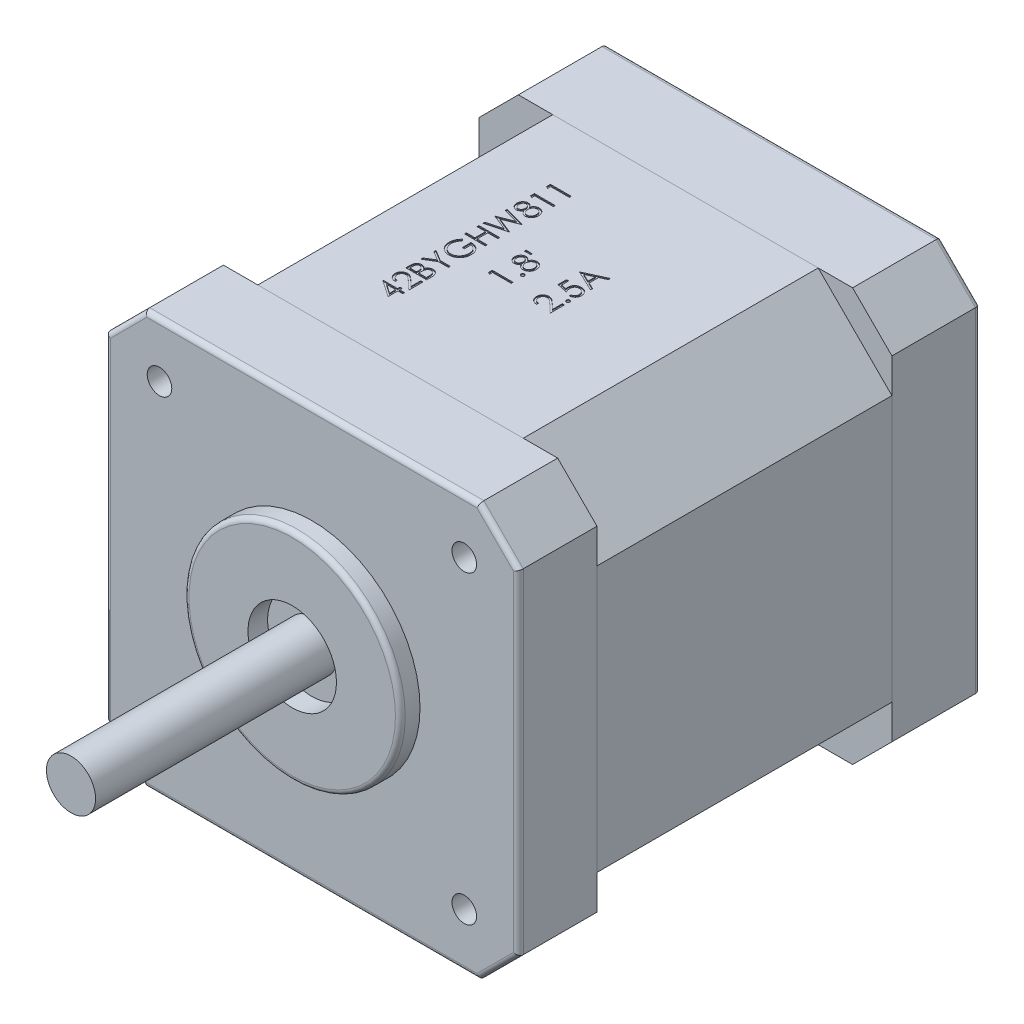
from build123d import *

# Parameters (mm, degrees)
IZIM1_R                     = 2.5
Y_KSEKLIK_EKSTR_ZYON1_DEPTH = 24.5
IZIM1_4_R                   = 11
IZIM1_4_R_2                 = 4.5
Y_KSEKLIK_EKSTR_ZYON2_DEPTH = 2
Y_KSEKLIK_EKSTR_ZYON3_START = -8
IZIM1_5_W                   = 42
IZIM1_5_H                   = 42
IZIM1_5_R                   = 11
IZIM1_5_R_2                 = 4.5
IZIM1_5_R_3                 = 2.5
Y_KSEKLIK_EKSTR_ZYON3_DEPTH = 8
PAH1_SIZE                   = 4
Y_KSEKLIK_EKSTR_ZYON4_DEPTH = 30
Y_KSEKLIK_EKSTR_ZYON5_DEPTH = 9
IZIM4_R                     = 4.5
KES_EKSTR_ZYON1_DEPTH       = 3.5
M3_DI_LI_DELIK1_D           = 2.5
M3_DI_LI_DELIK1_DEPTH       = 7
M3_DI_LI_DELIK1_TIP         = 0.751075774
RADYUS1_R                   = 0.5
RADYUS2_R                   = 0.5
KES_EKSTR_ZYON2_DEPTH       = 0.1
IZIM11_R                    = 0.6


with BuildPart() as part:
    # Çizim1 → Yükseklik-Ekstrüzyon1 (new body)
    with BuildSketch(Plane.XY):
        Circle(IZIM1_R)
    extrude(amount=Y_KSEKLIK_EKSTR_ZYON1_DEPTH)



with BuildPart() as body_2:
    # Çizim1<4> → Yükseklik-Ekstrüzyon2 (new body)
    with BuildSketch(Plane.XY):
        Circle(IZIM1_4_R)
        Circle(IZIM1_4_R_2, mode=Mode.SUBTRACT)
    extrude(amount=Y_KSEKLIK_EKSTR_ZYON2_DEPTH)


with BuildPart() as part_1:
    add(part.part)

    add(body_2.part)  # Yükseklik-Ekstrüzyon3 merges body 2
    # Çizim1<5> → Yükseklik-Ekstrüzyon3 (add)
    # profile 1 of 4: a face of its own
    with BuildSketch(Plane.XY.offset(Y_KSEKLIK_EKSTR_ZYON3_START)):
        Rectangle(IZIM1_5_W, IZIM1_5_H)
        Circle(IZIM1_5_R, mode=Mode.SUBTRACT)
    # profile 2 of 4: a face of its own
    with BuildSketch(Plane.XY.offset(Y_KSEKLIK_EKSTR_ZYON3_START)):
        Circle(IZIM1_5_R)
        Circle(IZIM1_5_R_2, mode=Mode.SUBTRACT)
    # profile 3 of 4: a face of its own
    with BuildSketch(Plane.XY.offset(Y_KSEKLIK_EKSTR_ZYON3_START)):
        Circle(IZIM1_5_R_2)
        Circle(IZIM1_5_R_3, mode=Mode.SUBTRACT)
    # profile 4 of 4: a face of its own
    with BuildSketch(Plane.XY.offset(Y_KSEKLIK_EKSTR_ZYON3_START)):
        Circle(IZIM1_5_R_3)
    extrude(amount=Y_KSEKLIK_EKSTR_ZYON3_DEPTH)

    # Pah1
    pah1_edges = [part_1.edges().sort_by_distance(p)[0] for p in [
        (-21, -21, -4),
        (-21, 21, -4),
        (21, 21, -4),
        (21, -21, -4),
    ]]
    chamfer(pah1_edges, length=PAH1_SIZE)

    # Çizim2 → Yükseklik-Ekstrüzyon4 (add)
    with BuildSketch(Plane(origin=(0, 0, -8), x_dir=(-1, 0, 0), z_dir=(0, 0, -1))):
        Polygon((-13.5, 21), (13.5, 21), (21, 13.5), (21, -13.5), (13.5, -21), (-13.5, -21), (-21, -13.5), (-21, 13.5), align=None)
    extrude(amount=Y_KSEKLIK_EKSTR_ZYON4_DEPTH)

    # Çizim3 → Yükseklik-Ekstrüzyon5 (add)
    with BuildSketch(Plane(origin=(0, 0, -38), x_dir=(-1, 0, 0), z_dir=(0, 0, -1))):
        Polygon((-17, -21), (17, -21), (21, -17), (21, 17), (17, 21), (-17, 21), (-21, 17), (-21, -17), align=None)
    extrude(amount=Y_KSEKLIK_EKSTR_ZYON5_DEPTH)

    # Çizim4 → Kes-Ekstrüzyon1 (cut)
    with BuildSketch(Plane(origin=(0, 0, -47), x_dir=(-1, 0, 0), z_dir=(0, 0, -1))):
        with Locations(Location((0, 0, 0), (0, 0, 180))):
            Circle(IZIM4_R)
    extrude(amount=-KES_EKSTR_ZYON1_DEPTH, mode=Mode.SUBTRACT)

    # M3 Dişli Delik1
    with Locations(Plane.XY):
        with Locations((-15.5, 15.5), (15.5, 15.5), (15.5, -15.5), (-15.5, -15.5)):
            Hole(M3_DI_LI_DELIK1_D / 2, depth=M3_DI_LI_DELIK1_DEPTH)
            with Locations((0, 0, -(M3_DI_LI_DELIK1_DEPTH + M3_DI_LI_DELIK1_TIP / 2))):  # 118° drill point
                Cone(0, M3_DI_LI_DELIK1_D / 2, M3_DI_LI_DELIK1_TIP, mode=Mode.SUBTRACT)

    # Radyus1
    radyus1_edges = [part_1.edges().sort_by_distance(p)[0] for p in [
        (-11, 0, 2),
    ]]
    fillet(radyus1_edges, radius=RADYUS1_R)

    # Radyus2
    radyus2_edges = [part_1.edges().sort_by_distance(p)[0] for p in [
        (-4.5, 0, -47),
        (0, -21, 0),
        (-21, 0, 0),
        (21, 0, 0),
        (0, 21, 0),
        (19, 19, 0),
        (-19, 19, 0),
        (-19, -19, 0),
        (19, -19, 0),
        (-19, -19, -47),
        (-21, 0, -47),
        (-19, 19, -47),
        (0, 21, -47),
        (19, 19, -47),
        (21, 0, -47),
        (19, -19, -47),
        (0, -21, -47),
    ]]
    fillet(radyus2_edges, radius=RADYUS2_R)

    # Çizim9 → Kes-Ekstrüzyon2 (cut)
    # profile 1 of 18: a face of its own
    with BuildSketch(Plane(origin=(0, 21, 0), x_dir=(1, 0, 0), z_dir=(0, 1, 0))):
        Polygon((-7.48076484, 31.358758021), (-7.48076484, 31.750120868), (-5.364098173, 31.750120868), (-5.364098173, 31.560163603), (-7.263670823, 31.560163603), (-7.263670823, 31.234522577), align=None)
    # profile 2 of 18: a face of its own
    with BuildSketch(Plane(origin=(0, 21, 0), x_dir=(1, 0, 0), z_dir=(0, 1, 0))):
        Polygon((-7.48076484, 29.730552893), (-7.48076484, 30.12191574), (-5.364098173, 30.12191574), (-5.364098173, 29.931958475), (-7.263670823, 29.931958475), (-7.263670823, 29.606317449), align=None)
    # profile 3 of 18: a face of its own
    with BuildSketch(Plane(origin=(0, 21, 0), x_dir=(1, 0, 0), z_dir=(0, 1, 0))):
        with BuildLine():
            add(Edge.make_bspline(
                [(-6.543274856, 28.681547818), (-6.534253768, 28.698882093), (-6.516659635, 28.732689719), (-6.488152234, 28.780626515), (-6.45888197, 28.825043357), (-6.428289612, 28.865697076), (-6.397059915, 28.90310779), (-6.364791186, 28.936723711), (-6.331527054, 28.966686908), (-6.297144511, 28.992949637), (-6.261637512, 29.01619211), (-6.224780324, 29.035908924), (-6.187070227, 29.053109242), (-6.147944074, 29.066611163), (-6.107936156, 29.077758044), (-6.066510295, 29.085422119), (-6.023944767, 29.089545175), (-5.995177238, 29.09032454), (-5.980611261, 29.090719159)],
                knots=[0, 0, 0, 0, 1.272232798, 2.48127884, 3.629933602, 4.734339846, 5.792529071, 6.8014233, 7.765980239, 8.70477066, 9.616091719, 10.526157162, 11.424183119, 12.311964017, 13.218439077, 14.126407968, 15.05133675, 16, 16, 16, 16], degree=3))
            add(Edge.make_bspline(
                [(-5.980611261, 29.090719159), (-5.960232667, 29.090251116), (-5.919895782, 29.089324684), (-5.860351898, 29.081303416), (-5.802424948, 29.069151179), (-5.746227356, 29.051848089), (-5.69229116, 29.028724822), (-5.640304419, 29.000759187), (-5.589380456, 28.968920348), (-5.558040871, 28.943370755), (-5.542183109, 28.930442716)],
                knots=[0, 0, 0, 0, 1.025234619, 2.029323995, 3.018511574, 4.001747246, 4.983437759, 5.966776356, 6.971193253, 8, 8, 8, 8], degree=3))
            add(Edge.make_bspline(
                [(-5.542183109, 28.930442716), (-5.52368116, 28.913608277), (-5.486905895, 28.880147427), (-5.439159453, 28.822826323), (-5.399033867, 28.75991785), (-5.366333245, 28.69166543), (-5.340881321, 28.618251507), (-5.322591798, 28.539691723), (-5.312115853, 28.455832926), (-5.310601535, 28.398195807), (-5.309824669, 28.368627145)],
                knots=[0, 0, 0, 0, 0.954267603, 1.896743057, 2.838368354, 3.796610408, 4.779680527, 5.799409237, 6.871065594, 8, 8, 8, 8], degree=3))
            add(Edge.make_bspline(
                [(-5.309824669, 28.368627145), (-5.310521644, 28.340195238), (-5.311877886, 28.284869636), (-5.321066899, 28.204340824), (-5.33717042, 28.129275923), (-5.359210726, 28.059238455), (-5.387882644, 27.994650713), (-5.423568618, 27.935696505), (-5.464832628, 27.881526103), (-5.512858364, 27.833780322), (-5.564301308, 27.79140065), (-5.617358856, 27.754141293), (-5.671990135, 27.723346384), (-5.72736472, 27.69680369), (-5.784604471, 27.677050764), (-5.843122014, 27.663040688), (-5.902751097, 27.654240405), (-5.942985755, 27.653063411), (-5.963226779, 27.652471295)],
                knots=[0, 0, 0, 0, 1.25688423, 2.445769047, 3.576901867, 4.645929967, 5.686364546, 6.692558921, 7.686102643, 8.689032542, 9.678639083, 10.630214757, 11.550908986, 12.44815258, 13.341318614, 14.221806242, 15.105436345, 16, 16, 16, 16], degree=3))
            add(Edge.make_bspline(
                [(-5.963226779, 27.652471295), (-5.978079198, 27.652820878), (-6.00743282, 27.653511777), (-6.050800536, 27.658290847), (-6.093008186, 27.665981929), (-6.134225967, 27.676399487), (-6.174223055, 27.690664312), (-6.213255716, 27.707526057), (-6.251068002, 27.727571747), (-6.287940088, 27.750584344), (-6.323431869, 27.777375896), (-6.358116199, 27.807734631), (-6.391556957, 27.84206515), (-6.423561436, 27.880612719), (-6.45578492, 27.922023826), (-6.485840557, 27.968050041), (-6.516002545, 28.017229588), (-6.534028107, 28.052189265), (-6.543274856, 28.070122871)],
                knots=[0, 0, 0, 0, 0.941515718, 1.860767376, 2.762381872, 3.659935523, 4.55260077, 5.451495189, 6.353332278, 7.263234701, 8.204067976, 9.169206831, 10.183030162, 11.238523545, 12.34427893, 13.507326683, 14.721309093, 16, 16, 16, 16], degree=3))
            add(Edge.make_bspline(
                [(-6.543274856, 28.070122871), (-6.556702083, 28.045607178), (-6.582660298, 27.998212163), (-6.629722407, 27.934815616), (-6.681807098, 27.881200726), (-6.738380258, 27.837324513), (-6.798312673, 27.802960483), (-6.861105408, 27.779355845), (-6.925645395, 27.763394239), (-6.969735998, 27.761812626), (-6.99187929, 27.761018304)],
                knots=[0, 0, 0, 0, 1.166795445, 2.255709742, 3.287146686, 4.280506455, 5.237809939, 6.161201476, 7.076514059, 8, 8, 8, 8], degree=3))
            add(Edge.make_bspline(
                [(-6.99187929, 27.761018304), (-7.014434415, 27.762009081), (-7.059774151, 27.764000717), (-7.12728494, 27.780050579), (-7.193629536, 27.806401938), (-7.258645004, 27.841636061), (-7.319404266, 27.886451869), (-7.37415459, 27.939508983), (-7.422098209, 28.000380217), (-7.462366798, 28.068502961), (-7.495133403, 28.141824336), (-7.517738879, 28.219182273), (-7.532516797, 28.29923265), (-7.53418998, 28.353720296), (-7.535038344, 28.381347497)],
                knots=[0, 0, 0, 0, 0.888671842, 1.786385383, 2.719922424, 3.697584571, 4.694127107, 5.68736021, 6.695307759, 7.740011808, 8.800474061, 9.853175224, 10.911482437, 12, 12, 12, 12], degree=3))
            add(Edge.make_bspline(
                [(-7.535038344, 28.381347497), (-7.534163684, 28.408261743), (-7.532438953, 28.46133357), (-7.518053082, 28.539344116), (-7.49402796, 28.613988623), (-7.46142632, 28.684998614), (-7.421302427, 28.751143659), (-7.372657328, 28.809394746), (-7.318552835, 28.861275345), (-7.257447409, 28.903949476), (-7.192682004, 28.938908334), (-7.125097585, 28.963521739), (-7.05605486, 28.979196786), (-7.009345548, 28.981179011), (-6.985943125, 28.98217215)],
                knots=[0, 0, 0, 0, 1.072838999, 2.115516285, 3.151283082, 4.193045685, 5.225601509, 6.226687556, 7.21162948, 8.206378771, 9.189883966, 10.138656908, 11.067424936, 12, 12, 12, 12], degree=3))
            add(Edge.make_bspline(
                [(-6.985943125, 28.98217215), (-6.962978438, 28.981299209), (-6.917877096, 28.979584802), (-6.852222201, 28.965356673), (-6.790871353, 28.941012482), (-6.732836711, 28.908206273), (-6.679294483, 28.86507899), (-6.6291198, 28.813003892), (-6.582888678, 28.751435519), (-6.556755652, 28.705330977), (-6.543274856, 28.681547818)],
                knots=[0, 0, 0, 0, 0.97540661, 1.915643144, 2.83819279, 3.771804602, 4.738123289, 5.749225578, 6.838931607, 8, 8, 8, 8], degree=3))
        make_face()
        with BuildLine():
            add(Edge.make_bspline(
                [(-7.317944327, 28.370747204), (-7.317551636, 28.355899293), (-7.31678336, 28.326850286), (-7.312738607, 28.284264977), (-7.304969269, 28.243736491), (-7.294325381, 28.205043203), (-7.281082251, 28.168052565), (-7.263633977, 28.133612838), (-7.244240147, 28.10056665), (-7.221492068, 28.069998113), (-7.196673422, 28.042325825), (-7.170754255, 28.017609594), (-7.142970482, 27.997473536), (-7.114712088, 27.980149747), (-7.084806986, 27.967284414), (-7.053909957, 27.958145325), (-7.021825301, 27.951677521), (-6.999967843, 27.951211371), (-6.988911207, 27.950975569)],
                knots=[0, 0, 0, 0, 1.20353747, 2.354645537, 3.462130888, 4.543058862, 5.604822423, 6.639552563, 7.666902586, 8.706944258, 9.720926464, 10.677177239, 11.602682187, 12.496457588, 13.358248655, 14.231532794, 15.105417644, 16, 16, 16, 16], degree=3))
            add(Edge.make_bspline(
                [(-6.988911207, 27.950975569), (-6.977855852, 27.951391262), (-6.95600888, 27.952212732), (-6.923747333, 27.958565833), (-6.892044724, 27.968034503), (-6.861654887, 27.982942283), (-6.831523618, 28.000822891), (-6.802403978, 28.022891545), (-6.774194626, 28.049192053), (-6.747135497, 28.078841981), (-6.721796721, 28.111143244), (-6.699799607, 28.145363118), (-6.681394216, 28.181072126), (-6.666075957, 28.217903377), (-6.654168233, 28.256232248), (-6.645720528, 28.295823877), (-6.640469987, 28.336684919), (-6.639842836, 28.36437127), (-6.639525524, 28.378379415)],
                knots=[0, 0, 0, 0, 0.873023192, 1.725219244, 2.590779336, 3.480155217, 4.391973325, 5.357036234, 6.360879153, 7.436073238, 8.526419356, 9.601555421, 10.645666583, 11.697338044, 12.750135903, 13.812665442, 14.89329948, 16, 16, 16, 16], degree=3))
            add(Edge.make_bspline(
                [(-6.639525524, 28.378379415), (-6.640050738, 28.396372222), (-6.641095981, 28.432180121), (-6.650902959, 28.484947407), (-6.666134124, 28.536383319), (-6.68775201, 28.585514603), (-6.714109407, 28.631461924), (-6.745192156, 28.672929378), (-6.781730208, 28.708181629), (-6.821604083, 28.738172324), (-6.86390063, 28.761620801), (-6.906519974, 28.779582702), (-6.949813167, 28.790160676), (-6.978822936, 28.791535726), (-6.993151325, 28.792214885)],
                knots=[0, 0, 0, 0, 1.076561449, 2.142489767, 3.202892658, 4.283174188, 5.348766409, 6.369549039, 7.375093932, 8.378927502, 9.349008457, 10.26378795, 11.142457041, 12, 12, 12, 12], degree=3))
            add(Edge.make_bspline(
                [(-6.993151325, 28.792214885), (-7.003208953, 28.791898332), (-7.023171904, 28.791270019), (-7.052756886, 28.785909047), (-7.081652838, 28.777481166), (-7.109919491, 28.765419305), (-7.137420534, 28.749929571), (-7.164886329, 28.731822333), (-7.191047006, 28.709350684), (-7.216810805, 28.684346216), (-7.240584431, 28.655928371), (-7.261647889, 28.624368631), (-7.278821837, 28.589299222), (-7.293409146, 28.551471745), (-7.304213397, 28.51047856), (-7.312352627, 28.466704923), (-7.316928715, 28.419746571), (-7.317598447, 28.387434571), (-7.317944327, 28.370747204)],
                knots=[0, 0, 0, 0, 0.814197944, 1.616066217, 2.427603245, 3.248455667, 4.099186941, 4.981981106, 5.90846497, 6.888109974, 7.887887681, 8.904052014, 9.953721043, 11.044545063, 12.183287691, 13.382474488, 14.648192314, 16, 16, 16, 16], degree=3))
        make_face(mode=Mode.SUBTRACT)
        with BuildLine():
            add(Edge.make_bspline(
                [(-6.422431507, 28.383043544), (-6.422096465, 28.364219972), (-6.421439194, 28.327292717), (-6.414131048, 28.273190915), (-6.403941903, 28.221276233), (-6.388542964, 28.17168812), (-6.368341665, 28.124639004), (-6.344792295, 28.079324212), (-6.316131377, 28.03684936), (-6.283567863, 27.997301237), (-6.248453816, 27.96101112), (-6.210896371, 27.929614833), (-6.172350331, 27.90254782), (-6.131936601, 27.880901426), (-6.090547428, 27.863107984), (-6.04711952, 27.851429365), (-6.002496261, 27.84394093), (-5.972161293, 27.842935494), (-5.956866603, 27.84242856)],
                knots=[0, 0, 0, 0, 1.140120093, 2.236637429, 3.303440304, 4.343881959, 5.376465234, 6.40341898, 7.434544382, 8.475444373, 9.50525236, 10.49018835, 11.438301835, 12.354413346, 13.264416842, 14.162243115, 15.073415118, 16, 16, 16, 16], degree=3))
            add(Edge.make_bspline(
                [(-5.956866603, 27.84242856), (-5.937862927, 27.84327052), (-5.900022071, 27.844947062), (-5.844216202, 27.857702001), (-5.790358932, 27.878811974), (-5.738701029, 27.907713215), (-5.690391775, 27.943721779), (-5.648173451, 27.987785079), (-5.611265075, 28.037810207), (-5.580842584, 28.094558127), (-5.556856718, 28.156851216), (-5.539481752, 28.22412554), (-5.528641199, 28.295910184), (-5.527501905, 28.345408413), (-5.526918686, 28.370747204)],
                knots=[0, 0, 0, 0, 0.898929492, 1.789983246, 2.69439732, 3.628772362, 4.584083338, 5.535003999, 6.506411961, 7.518169435, 8.572915583, 9.658441722, 10.801325702, 12, 12, 12, 12], degree=3))
            add(Edge.make_bspline(
                [(-5.526918686, 28.370747204), (-5.527303848, 28.390551827), (-5.528054268, 28.429137584), (-5.534526719, 28.485453906), (-5.545131095, 28.538463206), (-5.559367314, 28.588598373), (-5.578594462, 28.635440763), (-5.602096835, 28.679192087), (-5.629096435, 28.72040248), (-5.661048106, 28.757216478), (-5.695208648, 28.790738885), (-5.731366391, 28.819969399), (-5.768544766, 28.845343631), (-5.807582375, 28.865259043), (-5.847730669, 28.881180152), (-5.889359759, 28.892624399), (-5.932597353, 28.899685729), (-5.961927744, 28.90039989), (-5.976795155, 28.900761894)],
                knots=[0, 0, 0, 0, 1.224881218, 2.3864614, 3.501053153, 4.5663711, 5.605533372, 6.626474706, 7.635288001, 8.646258782, 9.635558885, 10.592810877, 11.51917626, 12.414699553, 13.29797396, 14.186770504, 15.080884095, 16, 16, 16, 16], degree=3))
            add(Edge.make_bspline(
                [(-5.976795155, 28.900761894), (-5.991235286, 28.9002141), (-6.019708703, 28.899133948), (-6.061900474, 28.892277522), (-6.102664524, 28.880234786), (-6.142482785, 28.863702022), (-6.18058093, 28.84172416), (-6.21791194, 28.8156582), (-6.253837174, 28.784686123), (-6.287855769, 28.749188827), (-6.319293601, 28.710694649), (-6.34723457, 28.669905409), (-6.370070277, 28.626627756), (-6.389254068, 28.581720958), (-6.404204071, 28.534731794), (-6.414687222, 28.485887048), (-6.421275872, 28.43509415), (-6.422041943, 28.400589761), (-6.422431507, 28.383043544)],
                knots=[0, 0, 0, 0, 0.917285732, 1.808727228, 2.70647511, 3.61182169, 4.540502712, 5.494399442, 6.50027777, 7.547876848, 8.61347749, 9.654284431, 10.682470341, 11.71628462, 12.752590585, 13.809114363, 14.885888007, 16, 16, 16, 16], degree=3))
        make_face(mode=Mode.SUBTRACT)
    # profile 4 of 18: a face of its own
    with BuildSketch(Plane(origin=(0, 21, 0), x_dir=(1, 0, 0), z_dir=(0, 1, 0))):
        Polygon((-7.48076484, 24.884522577), (-7.48076484, 25.080840019), (-5.928457815, 25.495099501), (-7.48076484, 26.111188576), (-7.48076484, 26.13874934), (-5.939058109, 26.743390099), (-7.48076484, 27.159769639), (-7.48076484, 27.353967022), (-5.364098173, 26.783247204), (-5.364098173, 26.756110451), (-6.982975043, 26.1192448), (-5.364098173, 25.474746936), (-5.364098173, 25.447610184), align=None)
    # profile 5 of 18: a face of its own
    with BuildSketch(Plane(origin=(0, 21, 0), x_dir=(1, 0, 0), z_dir=(0, 1, 0))):
        Polygon((-7.48076484, 23.01208668), (-7.48076484, 23.202043945), (-6.612388771, 23.202043945), (-6.612388771, 24.28751403), (-7.48076484, 24.28751403), (-7.48076484, 24.477471295), (-5.364098173, 24.477471295), (-5.364098173, 24.28751403), (-6.395294754, 24.28751403), (-6.395294754, 23.202043945), (-5.364098173, 23.202043945), (-5.364098173, 23.01208668), align=None)
    # profile 6 of 18: a face of its own
    with BuildSketch(Plane(origin=(0, 21, 0), x_dir=(1, 0, 0), z_dir=(0, 1, 0))):
        with BuildLine():
            Line((-7.119506827, 22.442214885), (-6.965166549, 22.279394372))
            add(Edge.make_bspline(
                [(-6.965166549, 22.279394372), (-6.992892598, 22.249936976), (-7.047683552, 22.191724612), (-7.118660066, 22.096656075), (-7.180063313, 21.997864678), (-7.229651122, 21.895190682), (-7.268550412, 21.791326453), (-7.296826638, 21.688057943), (-7.314733735, 21.586053782), (-7.316884521, 21.518221085), (-7.317944327, 21.484796349)],
                knots=[0, 0, 0, 0, 1.089067066, 2.152164705, 3.18986567, 4.218445106, 5.218487318, 6.173592265, 7.100032889, 8, 8, 8, 8], degree=3))
            add(Edge.make_bspline(
                [(-7.317944327, 21.484796349), (-7.317694194, 21.46428603), (-7.317194577, 21.423318588), (-7.310817837, 21.362466269), (-7.301646705, 21.30225216), (-7.288377093, 21.242789929), (-7.271559234, 21.18396396), (-7.250522309, 21.125978851), (-7.225996049, 21.068726422), (-7.197655383, 21.01274602), (-7.166522435, 20.958474243), (-7.132021276, 20.907217045), (-7.095259902, 20.858644709), (-7.055309768, 20.813681141), (-7.012562595, 20.772027249), (-6.96778822, 20.732916873), (-6.920106329, 20.697078938), (-6.869713, 20.665156194), (-6.817780612, 20.636328649), (-6.764749602, 20.611417175), (-6.711112269, 20.589760679), (-6.656464735, 20.573266427), (-6.601370392, 20.559295898), (-6.54554052, 20.549570579), (-6.488829325, 20.544069473), (-6.45085167, 20.5431197), (-6.431759765, 20.542642236)],
                knots=[0, 0, 0, 0, 1.028150113, 2.053633673, 3.06513288, 4.081487945, 5.106702018, 6.131327874, 7.172780699, 8.228344599, 9.276313556, 10.308389736, 11.324843658, 12.329040066, 13.321460474, 14.316307835, 15.308626991, 16.309440696, 17.305625405, 18.28535951, 19.246194545, 20.203493668, 21.145557131, 22.095268976, 23.042464743, 24, 24, 24, 24], degree=3))
            add(Edge.make_bspline(
                [(-6.431759765, 20.542642236), (-6.412243699, 20.543099554), (-6.373264857, 20.544012941), (-6.315088938, 20.549850827), (-6.257783767, 20.560709454), (-6.20125921, 20.575109893), (-6.145402774, 20.593417654), (-6.090272749, 20.615910269), (-6.035874495, 20.642704931), (-5.982748026, 20.673651364), (-5.931040803, 20.707826138), (-5.88192659, 20.745412807), (-5.835976951, 20.78647465), (-5.792520731, 20.830258773), (-5.751832181, 20.877164104), (-5.714401742, 20.927645716), (-5.679650624, 20.98099696), (-5.647960595, 21.037241504), (-5.619653282, 21.095784863), (-5.594480545, 21.155811371), (-5.573749759, 21.217513959), (-5.556853844, 21.280568048), (-5.543004621, 21.344898554), (-5.534094977, 21.410831996), (-5.52762957, 21.477883587), (-5.527156845, 21.523082664), (-5.526918686, 21.545854041)],
                knots=[0, 0, 0, 0, 0.935915162, 1.869274651, 2.799799983, 3.730201895, 4.664668062, 5.616159355, 6.583070886, 7.570012957, 8.562524459, 9.553461134, 10.53281078, 11.515274572, 12.509912756, 13.507571325, 14.526460018, 15.561318395, 16.601025881, 17.643204557, 18.680545676, 19.719612342, 20.772381578, 21.833430283, 22.908478249, 24, 24, 24, 24], degree=3))
            add(Edge.make_bspline(
                [(-5.526918686, 21.545854041), (-5.527492111, 21.573297249), (-5.528618124, 21.627186445), (-5.537390722, 21.70640047), (-5.55107435, 21.782487148), (-5.571176061, 21.855198783), (-5.596619876, 21.924799256), (-5.628084779, 21.991031865), (-5.665239708, 22.054079499), (-5.707332282, 22.113669267), (-5.75423064, 22.168384508), (-5.804386392, 22.21818186), (-5.858449343, 22.261348932), (-5.915613767, 22.299175166), (-5.976426451, 22.33043969), (-6.040549091, 22.35610934), (-6.108021364, 22.37578373), (-6.154643379, 22.383860379), (-6.178200737, 22.387941381)],
                knots=[0, 0, 0, 0, 1.130199668, 2.219330667, 3.279027493, 4.311506524, 5.322739849, 6.327972234, 7.327472899, 8.33386792, 9.329086447, 10.29244429, 11.240784345, 12.174119183, 13.111530729, 14.052100829, 15.015757696, 16, 16, 16, 16], degree=3))
            Line((-6.178200737, 22.387941381), (-6.178200737, 21.682385825))
            Line((-6.178200737, 21.682385825), (-6.395294754, 21.682385825))
            Line((-6.395294754, 21.682385825), (-6.395294754, 22.577898646))
            add(Edge.make_bspline(
                [(-6.395294754, 22.577898646), (-6.354831654, 22.576867014), (-6.275638057, 22.574847923), (-6.160146513, 22.560685055), (-6.051064584, 22.537815069), (-5.948277393, 22.506572881), (-5.851930601, 22.466129259), (-5.761926387, 22.416918254), (-5.678846204, 22.358152256), (-5.602011806, 22.291924513), (-5.533474616, 22.217599301), (-5.473236739, 22.137184945), (-5.422495634, 22.050548588), (-5.381214185, 21.95777218), (-5.348996103, 21.859159442), (-5.326153292, 21.754482184), (-5.312467552, 21.643882359), (-5.310718956, 21.568083511), (-5.309824669, 21.529317583)],
                knots=[0, 0, 0, 0, 1.140356446, 2.231883559, 3.274166699, 4.278491846, 5.25512956, 6.21435461, 7.1637429, 8.11826594, 9.068280886, 10.0076534, 10.945064095, 11.891975133, 12.864533718, 13.863980011, 14.907571808, 16, 16, 16, 16], degree=3))
            add(Edge.make_bspline(
                [(-5.309824669, 21.529317583), (-5.310168852, 21.505423358), (-5.310847691, 21.458296246), (-5.315672087, 21.388693637), (-5.323098912, 21.321010124), (-5.334314296, 21.255255566), (-5.348051254, 21.191188092), (-5.365641793, 21.129127677), (-5.38600334, 21.068837909), (-5.409163104, 21.010225603), (-5.435997392, 20.953822758), (-5.465817983, 20.89937815), (-5.498471111, 20.846590827), (-5.53452148, 20.79582036), (-5.573699444, 20.746802218), (-5.616083528, 20.699852469), (-5.661544157, 20.654708276), (-5.693825749, 20.626429329), (-5.710091763, 20.612180163)],
                knots=[0, 0, 0, 0, 1.107784379, 2.184907829, 3.233506516, 4.263428166, 5.276301166, 6.270063455, 7.25232949, 8.225834625, 9.190232166, 10.146266622, 11.1027726, 12.066435141, 13.031522626, 14.010570082, 14.99756817, 16, 16, 16, 16], degree=3))
            add(Edge.make_bspline(
                [(-5.710091763, 20.612180163), (-5.735897348, 20.591505814), (-5.787080173, 20.550500288), (-5.869085854, 20.497717784), (-5.95399555, 20.45272265), (-6.042045635, 20.41621449), (-6.133153749, 20.387707172), (-6.227203473, 20.367262438), (-6.324315916, 20.355283744), (-6.390032529, 20.353558033), (-6.42327953, 20.352684971)],
                knots=[0, 0, 0, 0, 1.023165419, 2.029347347, 3.013907458, 3.994755782, 4.975994455, 5.96558838, 6.970761222, 8, 8, 8, 8], degree=3))
            add(Edge.make_bspline(
                [(-6.42327953, 20.352684971), (-6.448175311, 20.353006848), (-6.497650464, 20.353646512), (-6.571103216, 20.361402896), (-6.643251733, 20.372531369), (-6.714037019, 20.38888841), (-6.783506423, 20.409508485), (-6.851691924, 20.43524339), (-6.918634805, 20.46520558), (-6.983870343, 20.500033647), (-7.046547633, 20.538779978), (-7.106359958, 20.580876037), (-7.162337941, 20.626646646), (-7.214611255, 20.676225084), (-7.263954658, 20.728611938), (-7.309337443, 20.784906986), (-7.351469775, 20.844257313), (-7.389542083, 20.907123003), (-7.423752166, 20.972512056), (-7.453741147, 21.040282332), (-7.47852648, 21.110409202), (-7.499556287, 21.182368344), (-7.515107838, 21.256704153), (-7.526385885, 21.332877267), (-7.534103011, 21.411284715), (-7.534723651, 21.464283647), (-7.535038344, 21.491156525)],
                knots=[0, 0, 0, 0, 1.00895651, 2.005089799, 2.991467152, 3.967318338, 4.948153826, 5.927364234, 6.919980553, 7.91976625, 8.923240147, 9.905815003, 10.88314567, 11.851989312, 12.825009789, 13.798721852, 14.781296708, 15.773896486, 16.776076962, 17.771600213, 18.775744723, 19.78957137, 20.808953803, 21.851964491, 22.910847925, 24, 24, 24, 24], degree=3))
            add(Edge.make_bspline(
                [(-7.535038344, 21.491156525), (-7.53468789, 21.513072034), (-7.533992979, 21.556527914), (-7.529176264, 21.621192523), (-7.521541821, 21.684857632), (-7.511123717, 21.74761764), (-7.496933771, 21.809258823), (-7.479953094, 21.869956783), (-7.460182325, 21.929799507), (-7.436603356, 21.988599448), (-7.40984045, 22.046751972), (-7.379715189, 22.104580418), (-7.345712449, 22.1618872), (-7.307731263, 22.218771699), (-7.266423958, 22.275592622), (-7.220609117, 22.331451239), (-7.17209345, 22.387695877), (-7.137209463, 22.423861736), (-7.119506827, 22.442214885)],
                knots=[0, 0, 0, 0, 0.985871117, 1.954866573, 2.915460327, 3.869826059, 4.81536089, 5.759505086, 6.70452669, 7.649098992, 8.607881297, 9.583363685, 10.581137262, 11.603961102, 12.659522466, 13.73993555, 14.853081303, 16, 16, 16, 16], degree=3))
        make_face()
    # profile 7 of 18: a face of its own
    with BuildSketch(Plane(origin=(0, 21, 0), x_dir=(1, 0, 0), z_dir=(0, 1, 0))):
        Polygon((-7.48076484, 18.56165933), (-7.48076484, 18.779177358), (-6.571259632, 19.335480777), (-7.48076484, 19.890936173), (-7.48076484, 20.108454201), (-6.370278061, 19.430035398), (-5.364098173, 19.430035398), (-5.364098173, 19.240078133), (-6.370278061, 19.240078133), align=None)
    # profile 8 of 18: a face of its own
    with BuildSketch(Plane(origin=(0, 21, 0), x_dir=(1, 0, 0), z_dir=(0, 1, 0))):
        with BuildLine():
            Line((-7.48076484, 17.04200121), (-7.48076484, 17.454988657))
            add(Edge.make_bspline(
                [(-7.48076484, 17.454988657), (-7.480660226, 17.475205245), (-7.480457458, 17.514390026), (-7.477239682, 17.571366023), (-7.472961952, 17.624750551), (-7.46578629, 17.674449275), (-7.458346076, 17.720785576), (-7.447425622, 17.763289045), (-7.435363583, 17.802315699), (-7.4168045, 17.849178722), (-7.387982009, 17.902351244), (-7.345235516, 17.959501755), (-7.293985922, 18.009180467), (-7.235582968, 18.051422097), (-7.1713331, 18.085321904), (-7.102618675, 18.109536652), (-7.030595732, 18.125093129), (-6.981217344, 18.126672903), (-6.956262302, 18.127471295)],
                knots=[0, 0, 0, 0, 1.00128172, 1.940733171, 2.826250472, 3.653024905, 4.427672124, 5.149348099, 5.824709082, 6.450061444, 7.643590664, 8.808605388, 9.972104426, 11.165284501, 12.367876273, 13.557044126, 14.765369432, 16, 16, 16, 16], degree=3))
            add(Edge.make_bspline(
                [(-6.956262302, 18.127471295), (-6.932887737, 18.126806293), (-6.886954512, 18.1254995), (-6.819887722, 18.113155722), (-6.756111126, 18.093564384), (-6.695679307, 18.066488363), (-6.639717207, 18.031602426), (-6.588398183, 17.989804169), (-6.543661811, 17.939583898), (-6.518661067, 17.901938613), (-6.505961822, 17.882816514)],
                knots=[0, 0, 0, 0, 1.044641374, 2.052818814, 3.038628718, 4.023282556, 5.005660861, 5.98021751, 6.974042014, 8, 8, 8, 8], degree=3))
            add(Edge.make_bspline(
                [(-6.505961822, 17.882816514), (-6.496727143, 17.906859784), (-6.479058914, 17.952860516), (-6.447870534, 18.016200751), (-6.413825436, 18.070573374), (-6.377220876, 18.117040527), (-6.337183141, 18.156572045), (-6.293386943, 18.190808626), (-6.245868137, 18.220406817), (-6.194801369, 18.245594673), (-6.140619556, 18.265380048), (-6.083984474, 18.279922025), (-6.025113235, 18.28852392), (-5.985162033, 18.28969735), (-5.964922826, 18.290291808)],
                knots=[0, 0, 0, 0, 1.272586185, 2.434772614, 3.483318042, 4.437947805, 5.351807173, 6.25737843, 7.180033415, 8.1141739, 9.066731021, 10.025721652, 10.999834114, 12, 12, 12, 12], degree=3))
            add(Edge.make_bspline(
                [(-5.964922826, 18.290291808), (-5.944259919, 18.289701178), (-5.903605071, 18.288539097), (-5.843882929, 18.279961746), (-5.786804143, 18.265448731), (-5.73202582, 18.245423622), (-5.679662811, 18.219467749), (-5.62990481, 18.18742377), (-5.582648296, 18.149741519), (-5.537809868, 18.107154484), (-5.496781296, 18.059694565), (-5.461510561, 18.007390681), (-5.431182755, 17.951675701), (-5.406490937, 17.891837364), (-5.387441216, 17.828028424), (-5.3741688, 17.760284388), (-5.365210861, 17.68871682), (-5.364475362, 17.639603897), (-5.364098173, 17.614417075)],
                knots=[0, 0, 0, 0, 0.978680899, 1.925582087, 2.851223405, 3.764209995, 4.683484765, 5.614004905, 6.562443559, 7.542772147, 8.539900013, 9.527881485, 10.525548727, 11.540192123, 12.58875426, 13.674701727, 14.807505862, 16, 16, 16, 16], degree=3))
            Line((-5.364098173, 17.614417075), (-5.364098173, 17.04200121))
            Line((-5.364098173, 17.04200121), (-7.48076484, 17.04200121))
        make_face()
        with BuildLine():
            Line((-7.263670823, 17.231958475), (-6.585252019, 17.231958475))
            Line((-6.585252019, 17.231958475), (-6.585252019, 17.359586012))
            add(Edge.make_bspline(
                [(-6.585252019, 17.359586012), (-6.585493878, 17.378242189), (-6.585961197, 17.414289723), (-6.587299848, 17.466492708), (-6.591048187, 17.514949268), (-6.594795456, 17.559575751), (-6.600888165, 17.600301916), (-6.608140601, 17.637037424), (-6.615810555, 17.670359169), (-6.628855733, 17.708784566), (-6.64812889, 17.752377644), (-6.678068296, 17.798819265), (-6.71369997, 17.83995143), (-6.755198561, 17.874268706), (-6.800397825, 17.902602741), (-6.848900952, 17.922451624), (-6.899731882, 17.935684283), (-6.934694763, 17.936897867), (-6.952446197, 17.93751403)],
                knots=[0, 0, 0, 0, 1.156917035, 2.235399477, 3.236897345, 4.169954739, 5.01148057, 5.788325709, 6.491867502, 7.129259015, 8.302032419, 9.437271567, 10.542795419, 11.662606952, 12.764338259, 13.836858145, 14.901724648, 16, 16, 16, 16], degree=3))
            add(Edge.make_bspline(
                [(-6.952446197, 17.93751403), (-6.964195703, 17.93720118), (-6.987243644, 17.936587491), (-7.020951375, 17.931378784), (-7.052624278, 17.922939295), (-7.082566334, 17.911509952), (-7.110033411, 17.895895774), (-7.136337957, 17.87779689), (-7.159904457, 17.855451248), (-7.181867496, 17.830198689), (-7.201524343, 17.801305257), (-7.217806993, 17.768148443), (-7.232564485, 17.731585401), (-7.243489017, 17.690624156), (-7.25309543, 17.646113438), (-7.259131204, 17.597450557), (-7.263015282, 17.544943879), (-7.263447435, 17.508563345), (-7.263670823, 17.48975762)],
                knots=[0, 0, 0, 0, 0.911708768, 1.788416306, 2.640049961, 3.452993646, 4.268229297, 5.087074648, 5.92553149, 6.781184137, 7.681934069, 8.628939405, 9.643570426, 10.73771997, 11.914765019, 13.176320755, 14.540391495, 16, 16, 16, 16], degree=3))
            Line((-7.263670823, 17.48975762), (-7.263670823, 17.231958475))
        make_face(mode=Mode.SUBTRACT)
        with BuildLine():
            Line((-6.368158002, 17.231958475), (-5.58119219, 17.231958475))
            Line((-5.58119219, 17.231958475), (-5.58119219, 17.502477973))
            add(Edge.make_bspline(
                [(-5.58119219, 17.502477973), (-5.581447342, 17.521839774), (-5.581939114, 17.559157094), (-5.583092421, 17.613079323), (-5.587455206, 17.662926475), (-5.591479856, 17.708855801), (-5.598361834, 17.750745405), (-5.604856632, 17.788917502), (-5.614497695, 17.822745472), (-5.627748203, 17.862332024), (-5.648960621, 17.906580638), (-5.679951763, 17.954936409), (-5.718199616, 17.997101892), (-5.761699306, 18.033297023), (-5.808866245, 18.063166817), (-5.859083813, 18.08460122), (-5.911375377, 18.097921322), (-5.947037744, 18.099528517), (-5.964922826, 18.100334543)],
                knots=[0, 0, 0, 0, 1.160376723, 2.23647316, 3.230273494, 4.158083346, 4.997711197, 5.773399541, 6.476071462, 7.102777513, 8.27340052, 9.405620712, 10.53304798, 11.669441455, 12.787990954, 13.865552736, 14.929550474, 16, 16, 16, 16], degree=3))
            add(Edge.make_bspline(
                [(-5.964922826, 18.100334543), (-5.976107135, 18.100168077), (-5.998295348, 18.09983783), (-6.03089807, 18.09483467), (-6.062495263, 18.087596683), (-6.093218598, 18.078064045), (-6.122551502, 18.064737931), (-6.150606468, 18.048401233), (-6.177948654, 18.029700979), (-6.212962691, 18.000850025), (-6.252803808, 17.958273376), (-6.291328897, 17.897767207), (-6.322899835, 17.82934941), (-6.336246676, 17.779610683), (-6.343141309, 17.753916942)],
                knots=[0, 0, 0, 0, 0.723302347, 1.434937762, 2.129609326, 2.821140842, 3.513216847, 4.209993937, 4.920569932, 5.655069131, 7.14393391, 8.6716197, 10.280644748, 12, 12, 12, 12], degree=3))
            add(Edge.make_bspline(
                [(-6.343141309, 17.753916942), (-6.345230812, 17.743618393), (-6.349761286, 17.721289016), (-6.354543564, 17.684877765), (-6.358804147, 17.64330893), (-6.361955657, 17.596486523), (-6.365213233, 17.544351305), (-6.366480101, 17.486791931), (-6.367991559, 17.424043459), (-6.368101102, 17.380505215), (-6.368158002, 17.357889965)],
                knots=[0, 0, 0, 0, 0.634451884, 1.375622551, 2.216452059, 3.157844607, 4.20941857, 5.370758133, 6.634282058, 8, 8, 8, 8], degree=3))
            Line((-6.368158002, 17.357889965), (-6.368158002, 17.231958475))
        make_face(mode=Mode.SUBTRACT)
    # profile 9 of 18: a face of its own
    with BuildSketch(Plane(origin=(0, 21, 0), x_dir=(1, 0, 0), z_dir=(0, 1, 0))):
        with BuildLine():
            Line((-6.829482789, 15.495206338), (-6.829482789, 15.305249073))
            add(Edge.make_bspline(
                [(-6.829482789, 15.305249073), (-6.854683754, 15.306487113), (-6.90417778, 15.308918591), (-6.976340332, 15.320305223), (-7.04531633, 15.33659804), (-7.110551944, 15.3596343), (-7.172623985, 15.388243334), (-7.231285899, 15.422551494), (-7.286313904, 15.463187775), (-7.337197871, 15.509274705), (-7.383877973, 15.559330024), (-7.424188525, 15.613338854), (-7.458247307, 15.670092752), (-7.486720249, 15.729419531), (-7.508092441, 15.791988539), (-7.52395029, 15.857231981), (-7.533491223, 15.925436507), (-7.534516769, 15.971906425), (-7.535038344, 15.995540206)],
                knots=[0, 0, 0, 0, 1.10065271, 2.161652631, 3.183658789, 4.190468796, 5.17591951, 6.163126047, 7.15150782, 8.156236427, 9.156009102, 10.134482811, 11.092018607, 12.041330605, 13.001268258, 13.972401359, 14.968799086, 16, 16, 16, 16], degree=3))
            add(Edge.make_bspline(
                [(-7.535038344, 15.995540206), (-7.534499401, 16.018751436), (-7.533440398, 16.064360675), (-7.524209208, 16.130898882), (-7.510063232, 16.19439229), (-7.489101124, 16.254121328), (-7.462798265, 16.310698983), (-7.430087212, 16.363424731), (-7.392515745, 16.413573536), (-7.348198356, 16.458684181), (-7.30091159, 16.50012375), (-7.250409722, 16.535842153), (-7.198189236, 16.566603123), (-7.143842213, 16.591780016), (-7.087191673, 16.610865221), (-7.028780744, 16.625005528), (-6.967935325, 16.633088892), (-6.92674589, 16.634322668), (-6.905804904, 16.634949928)],
                knots=[0, 0, 0, 0, 1.111674182, 2.184400057, 3.212814286, 4.223731311, 5.211378316, 6.196328225, 7.191884489, 8.207283132, 9.220262353, 10.201199469, 11.166417575, 12.120932471, 13.06540007, 14.026332106, 14.996573967, 16, 16, 16, 16], degree=3))
            add(Edge.make_bspline(
                [(-6.905804904, 16.634949928), (-6.876324083, 16.633925891), (-6.817879789, 16.631895787), (-6.731994424, 16.614530662), (-6.648783874, 16.587408303), (-6.581811889, 16.554755653), (-6.527851981, 16.521806316), (-6.483402122, 16.492143878), (-6.43555417, 16.457221605), (-6.384114459, 16.417337857), (-6.329756637, 16.37180578), (-6.271371658, 16.321808292), (-6.2100391, 16.266054189), (-6.168120845, 16.22695716), (-6.146399856, 16.206698058)],
                knots=[0, 0, 0, 0, 1.184416499, 2.348048165, 3.509039915, 4.696071444, 5.333504901, 6.05069495, 6.844171097, 7.714965912, 8.667477798, 9.695072654, 10.805644396, 12, 12, 12, 12], degree=3))
            Line((-6.146399856, 16.206698058), (-5.58119219, 15.67710738))
            Line((-5.58119219, 15.67710738), (-5.58119219, 16.66208668))
            Line((-5.58119219, 16.66208668), (-5.364098173, 16.66208668))
            Line((-5.364098173, 16.66208668), (-5.364098173, 15.223838817))
            Line((-5.364098173, 15.223838817), (-6.240106453, 16.044725569))
            add(Edge.make_bspline(
                [(-6.240106453, 16.044725569), (-6.260969715, 16.064711672), (-6.30104377, 16.103100885), (-6.359550227, 16.157397968), (-6.41382733, 16.206165356), (-6.463772529, 16.249718731), (-6.510116382, 16.28711328), (-6.551357941, 16.320297915), (-6.589309441, 16.34688663), (-6.633300194, 16.375743084), (-6.6870105, 16.403691539), (-6.75264754, 16.427708059), (-6.820215927, 16.442352277), (-6.865876682, 16.444109011), (-6.888844434, 16.444992663)],
                knots=[0, 0, 0, 0, 1.329631726, 2.553950428, 3.673215718, 4.687767853, 5.603093632, 6.413772471, 7.123043292, 7.734684054, 8.834405432, 9.900288307, 10.943827018, 12, 12, 12, 12], degree=3))
            add(Edge.make_bspline(
                [(-6.888844434, 16.444992663), (-6.903286994, 16.44460819), (-6.931750506, 16.443850468), (-6.97348256, 16.437163194), (-7.013738424, 16.427057317), (-7.052641922, 16.412576137), (-7.089801912, 16.393461584), (-7.125263626, 16.37019435), (-7.159546953, 16.343348931), (-7.191692042, 16.312293639), (-7.221132581, 16.278178101), (-7.247212385, 16.242137769), (-7.269007466, 16.204007468), (-7.286874248, 16.163947965), (-7.300889836, 16.122070943), (-7.310601453, 16.078295407), (-7.316698955, 16.032742312), (-7.317523954, 16.001637293), (-7.317944327, 15.985787935)],
                knots=[0, 0, 0, 0, 0.991446411, 1.95395049, 2.89581595, 3.838931463, 4.798493298, 5.75982156, 6.748411868, 7.785213223, 8.824556874, 9.840280684, 10.836137867, 11.835679398, 12.848801643, 13.863922112, 14.911575587, 16, 16, 16, 16], degree=3))
            add(Edge.make_bspline(
                [(-7.317944327, 15.985787935), (-7.317528966, 15.969230944), (-7.316713264, 15.936715746), (-7.310534735, 15.889077568), (-7.301168082, 15.84331902), (-7.286291792, 15.800122861), (-7.268714717, 15.758553706), (-7.246384937, 15.719498989), (-7.220437237, 15.682310283), (-7.19034982, 15.647599271), (-7.156544432, 15.615897069), (-7.119288561, 15.587650865), (-7.078850419, 15.563133164), (-7.035395973, 15.541711821), (-6.988492577, 15.524323493), (-6.938317387, 15.511034396), (-6.885085264, 15.500519654), (-6.848324781, 15.49700686), (-6.829482789, 15.495206338)],
                knots=[0, 0, 0, 0, 1.030878251, 2.024474673, 2.987898669, 3.934362936, 4.864849709, 5.795128259, 6.730474222, 7.685293701, 8.650606017, 9.611896181, 10.591709709, 11.591680886, 12.625074257, 13.701333388, 14.821793024, 16, 16, 16, 16], degree=3))
        make_face()
    # profile 10 of 18: a face of its own
    with BuildSketch(Plane(origin=(0, 21, 0), x_dir=(1, 0, 0), z_dir=(0, 1, 0))):
        Polygon((-7.535038344, 14.751065713), (-7.535038344, 14.789650783), (-6.069653729, 14.789650783), (-6.069653729, 15.033881552), (-5.852559712, 15.033881552), (-5.852559712, 14.789650783), (-5.364098173, 14.789650783), (-5.364098173, 14.599693518), (-5.852559712, 14.599693518), (-5.852559712, 13.595633689), align=None)
        Polygon((-6.069653729, 14.599693518), (-6.988911207, 14.599693518), (-6.069653729, 13.96876403), align=None, mode=Mode.SUBTRACT)
    # profile 11 of 18: a face of its own
    with BuildSketch(Plane(origin=(0, 21, 0), x_dir=(1, 0, 0), z_dir=(0, 1, 0))):
        Polygon((-2.274568259, 24.692021242), (-2.274568259, 24.560153587), (-2.92585031, 24.5317448), (-2.92585031, 24.721702065), align=None)
    # profile 12 of 18: a face of its own
    with BuildSketch(Plane(origin=(0, 21, 0), x_dir=(1, 0, 0), z_dir=(0, 1, 0))):
        with BuildLine():
            add(Edge.make_bspline(
                [(-1.934086822, 23.851205938), (-1.925065734, 23.868540213), (-1.907471601, 23.902347839), (-1.8789642, 23.950284635), (-1.849693936, 23.994701477), (-1.819101578, 24.035355196), (-1.787871881, 24.072765909), (-1.755603152, 24.106381831), (-1.72233902, 24.136345028), (-1.687956477, 24.162607757), (-1.652449478, 24.18585023), (-1.61559229, 24.205567044), (-1.577882192, 24.222767361), (-1.53875604, 24.236269283), (-1.498748122, 24.247416163), (-1.457322261, 24.255080239), (-1.414756733, 24.259203295), (-1.385989203, 24.25998266), (-1.371423227, 24.260377278)],
                knots=[0, 0, 0, 0, 1.272232798, 2.48127884, 3.629933602, 4.734339846, 5.792529071, 6.8014233, 7.765980239, 8.70477066, 9.616091719, 10.526157162, 11.424183119, 12.311964017, 13.218439077, 14.126407968, 15.05133675, 16, 16, 16, 16], degree=3))
            add(Edge.make_bspline(
                [(-1.371423227, 24.260377278), (-1.351044632, 24.259909236), (-1.310707748, 24.258982803), (-1.251163864, 24.250961535), (-1.193236913, 24.238809298), (-1.137039322, 24.221506208), (-1.083103126, 24.198382941), (-1.031116385, 24.170417306), (-0.980192422, 24.138578467), (-0.948852837, 24.113028874), (-0.932995075, 24.100100836)],
                knots=[0, 0, 0, 0, 1.025234619, 2.029323995, 3.018511574, 4.001747246, 4.983437759, 5.966776356, 6.971193253, 8, 8, 8, 8], degree=3))
            add(Edge.make_bspline(
                [(-0.932995075, 24.100100836), (-0.914493126, 24.083266397), (-0.877717861, 24.049805546), (-0.829971419, 23.992484442), (-0.789845833, 23.92957597), (-0.757145211, 23.86132355), (-0.731693287, 23.787909626), (-0.713403764, 23.709349843), (-0.702927819, 23.625491045), (-0.701413501, 23.567853927), (-0.700636635, 23.538285264)],
                knots=[0, 0, 0, 0, 0.954267603, 1.896743057, 2.838368354, 3.796610408, 4.779680527, 5.799409237, 6.871065594, 8, 8, 8, 8], degree=3))
            add(Edge.make_bspline(
                [(-0.700636635, 23.538285264), (-0.70133361, 23.509853358), (-0.702689852, 23.454527756), (-0.711878865, 23.373998944), (-0.727982385, 23.298934043), (-0.750022692, 23.228896574), (-0.77869461, 23.164308833), (-0.814380584, 23.105354624), (-0.855644594, 23.051184223), (-0.90367033, 23.003438441), (-0.955113273, 22.96105877), (-1.008170822, 22.923799413), (-1.062802101, 22.893004503), (-1.118176686, 22.86646181), (-1.175416436, 22.846708884), (-1.233933979, 22.832698807), (-1.293563063, 22.823898524), (-1.333797721, 22.822721531), (-1.354038745, 22.822129415)],
                knots=[0, 0, 0, 0, 1.25688423, 2.445769047, 3.576901867, 4.645929967, 5.686364546, 6.692558921, 7.686102643, 8.689032542, 9.678639083, 10.630214757, 11.550908986, 12.44815258, 13.341318614, 14.221806242, 15.105436345, 16, 16, 16, 16], degree=3))
            add(Edge.make_bspline(
                [(-1.354038745, 22.822129415), (-1.368891164, 22.822478998), (-1.398244786, 22.823169897), (-1.441612502, 22.827948967), (-1.483820152, 22.835640049), (-1.525037932, 22.846057606), (-1.56503502, 22.860322432), (-1.604067682, 22.877184177), (-1.641879967, 22.897229866), (-1.678752054, 22.920242463), (-1.714243835, 22.947034016), (-1.748928165, 22.977392751), (-1.782368923, 23.01172327), (-1.814373402, 23.050270839), (-1.846596886, 23.091681946), (-1.876652522, 23.137708161), (-1.90681451, 23.186887707), (-1.924840073, 23.221847385), (-1.934086822, 23.239780991)],
                knots=[0, 0, 0, 0, 0.941515718, 1.860767376, 2.762381872, 3.659935523, 4.55260077, 5.451495189, 6.353332278, 7.263234701, 8.204067976, 9.169206831, 10.183030162, 11.238523545, 12.34427893, 13.507326683, 14.721309093, 16, 16, 16, 16], degree=3))
            add(Edge.make_bspline(
                [(-1.934086822, 23.239780991), (-1.947514049, 23.215265298), (-1.973472264, 23.167870282), (-2.020534373, 23.104473736), (-2.072619063, 23.050858846), (-2.129192224, 23.006982633), (-2.189124638, 22.972618603), (-2.251917374, 22.949013965), (-2.316457361, 22.933052358), (-2.360547964, 22.931470745), (-2.382691255, 22.930676424)],
                knots=[0, 0, 0, 0, 1.166795445, 2.255709742, 3.287146686, 4.280506455, 5.237809939, 6.161201476, 7.076514059, 8, 8, 8, 8], degree=3))
            add(Edge.make_bspline(
                [(-2.382691255, 22.930676424), (-2.405246381, 22.931667201), (-2.450586117, 22.933658837), (-2.518096906, 22.949708699), (-2.584441501, 22.976060058), (-2.64945697, 23.01129418), (-2.710216232, 23.056109988), (-2.764966556, 23.109167102), (-2.812910175, 23.170038337), (-2.853178764, 23.238161081), (-2.885945369, 23.311482456), (-2.908550845, 23.388840393), (-2.923328763, 23.46889077), (-2.925001946, 23.523378416), (-2.92585031, 23.551005617)],
                knots=[0, 0, 0, 0, 0.888671842, 1.786385383, 2.719922424, 3.697584571, 4.694127107, 5.68736021, 6.695307759, 7.740011808, 8.800474061, 9.853175224, 10.911482437, 12, 12, 12, 12], degree=3))
            add(Edge.make_bspline(
                [(-2.92585031, 23.551005617), (-2.924975649, 23.577919863), (-2.923250919, 23.63099169), (-2.908865048, 23.709002236), (-2.884839926, 23.783646743), (-2.852238286, 23.854656733), (-2.812114393, 23.920801779), (-2.763469294, 23.979052865), (-2.709364801, 24.030933465), (-2.648259375, 24.073607595), (-2.58349397, 24.108566454), (-2.51590955, 24.133179858), (-2.446866825, 24.148854906), (-2.400157514, 24.15083713), (-2.376755091, 24.15183027)],
                knots=[0, 0, 0, 0, 1.072838999, 2.115516285, 3.151283082, 4.193045685, 5.225601509, 6.226687556, 7.21162948, 8.206378771, 9.189883966, 10.138656908, 11.067424936, 12, 12, 12, 12], degree=3))
            add(Edge.make_bspline(
                [(-2.376755091, 24.15183027), (-2.353790403, 24.150957329), (-2.308689062, 24.149242922), (-2.243034167, 24.135014793), (-2.181683319, 24.110670602), (-2.123648676, 24.077864393), (-2.070106449, 24.03473711), (-2.019931766, 23.982662012), (-1.973700644, 23.921093639), (-1.947567618, 23.874989097), (-1.934086822, 23.851205938)],
                knots=[0, 0, 0, 0, 0.97540661, 1.915643144, 2.83819279, 3.771804602, 4.738123289, 5.749225578, 6.838931607, 8, 8, 8, 8], degree=3))
        make_face()
        with BuildLine():
            add(Edge.make_bspline(
                [(-2.708756293, 23.540405323), (-2.708363602, 23.525557412), (-2.707595326, 23.496508406), (-2.703550572, 23.453923097), (-2.695781235, 23.413394611), (-2.685137346, 23.374701323), (-2.671894217, 23.337710685), (-2.654445943, 23.303270958), (-2.635052113, 23.27022477), (-2.612304034, 23.239656233), (-2.587485387, 23.211983945), (-2.56156622, 23.187267713), (-2.533782447, 23.167131656), (-2.505524054, 23.149807867), (-2.475618952, 23.136942534), (-2.444721923, 23.127803445), (-2.412637267, 23.121335641), (-2.390779808, 23.120869491), (-2.379723173, 23.120633689)],
                knots=[0, 0, 0, 0, 1.20353747, 2.354645537, 3.462130888, 4.543058862, 5.604822423, 6.639552563, 7.666902586, 8.706944258, 9.720926464, 10.677177239, 11.602682187, 12.496457588, 13.358248655, 14.231532794, 15.105417644, 16, 16, 16, 16], degree=3))
            add(Edge.make_bspline(
                [(-2.379723173, 23.120633689), (-2.368667817, 23.121049382), (-2.346820846, 23.121870852), (-2.314559299, 23.128223953), (-2.28285669, 23.137692622), (-2.252466853, 23.152600403), (-2.222335584, 23.17048101), (-2.193215943, 23.192549665), (-2.165006592, 23.218850172), (-2.137947463, 23.2485001), (-2.112608687, 23.280801364), (-2.090611573, 23.315021238), (-2.072206182, 23.350730246), (-2.056887923, 23.387561497), (-2.044980199, 23.425890368), (-2.036532494, 23.465481997), (-2.031281953, 23.506343039), (-2.030654802, 23.53402939), (-2.030337489, 23.548037535)],
                knots=[0, 0, 0, 0, 0.873023192, 1.725219244, 2.590779336, 3.480155217, 4.391973325, 5.357036234, 6.360879153, 7.436073238, 8.526419356, 9.601555421, 10.645666583, 11.697338044, 12.750135903, 13.812665442, 14.89329948, 16, 16, 16, 16], degree=3))
            add(Edge.make_bspline(
                [(-2.030337489, 23.548037535), (-2.030862704, 23.566030341), (-2.031907946, 23.601838241), (-2.041714925, 23.654605526), (-2.05694609, 23.706041439), (-2.078563976, 23.755172723), (-2.104921373, 23.801120044), (-2.136004121, 23.842587498), (-2.172542174, 23.877839749), (-2.212416048, 23.907830443), (-2.254712596, 23.931278921), (-2.29733194, 23.949240822), (-2.340625133, 23.959818796), (-2.369634901, 23.961193846), (-2.383963291, 23.961873005)],
                knots=[0, 0, 0, 0, 1.076561449, 2.142489767, 3.202892658, 4.283174188, 5.348766409, 6.369549039, 7.375093932, 8.378927502, 9.349008457, 10.26378795, 11.142457041, 12, 12, 12, 12], degree=3))
            add(Edge.make_bspline(
                [(-2.383963291, 23.961873005), (-2.394020919, 23.961556452), (-2.41398387, 23.960928139), (-2.443568852, 23.955567167), (-2.472464803, 23.947139286), (-2.500731457, 23.935077424), (-2.5282325, 23.919587691), (-2.555698295, 23.901480453), (-2.581858972, 23.879008803), (-2.607622771, 23.854004336), (-2.631396397, 23.825586491), (-2.652459854, 23.794026751), (-2.669633803, 23.758957342), (-2.684221112, 23.721129865), (-2.695025363, 23.680136679), (-2.703164593, 23.636363043), (-2.707740681, 23.589404691), (-2.708410413, 23.557092691), (-2.708756293, 23.540405323)],
                knots=[0, 0, 0, 0, 0.814197944, 1.616066217, 2.427603245, 3.248455667, 4.099186941, 4.981981106, 5.90846497, 6.888109974, 7.887887681, 8.904052014, 9.953721043, 11.044545063, 12.183287691, 13.382474488, 14.648192314, 16, 16, 16, 16], degree=3))
        make_face(mode=Mode.SUBTRACT)
        with BuildLine():
            add(Edge.make_bspline(
                [(-1.813243472, 23.552701664), (-1.81290843, 23.533878092), (-1.81225116, 23.496950837), (-1.804943014, 23.442849034), (-1.794753869, 23.390934353), (-1.77935493, 23.341346239), (-1.759153631, 23.294297123), (-1.735604261, 23.248982332), (-1.706943343, 23.20650748), (-1.674379829, 23.166959357), (-1.639265781, 23.13066924), (-1.601708337, 23.099272953), (-1.563162297, 23.072205939), (-1.522748566, 23.050559546), (-1.481359394, 23.032766104), (-1.437931486, 23.021087484), (-1.393308227, 23.013599049), (-1.362973259, 23.012593614), (-1.347678568, 23.01208668)],
                knots=[0, 0, 0, 0, 1.140120093, 2.236637429, 3.303440304, 4.343881959, 5.376465234, 6.40341898, 7.434544382, 8.475444373, 9.50525236, 10.49018835, 11.438301835, 12.354413346, 13.264416842, 14.162243115, 15.073415118, 16, 16, 16, 16], degree=3))
            add(Edge.make_bspline(
                [(-1.347678568, 23.01208668), (-1.328674893, 23.012928639), (-1.290834036, 23.014605181), (-1.235028168, 23.02736012), (-1.181170898, 23.048470093), (-1.129512995, 23.077371335), (-1.081203741, 23.113379898), (-1.038985417, 23.157443198), (-1.002077041, 23.207468326), (-0.971654549, 23.264216247), (-0.947668684, 23.326509336), (-0.930293718, 23.39378366), (-0.919453165, 23.465568303), (-0.918313871, 23.515066532), (-0.917730652, 23.540405323)],
                knots=[0, 0, 0, 0, 0.898929492, 1.789983246, 2.69439732, 3.628772362, 4.584083338, 5.535003999, 6.506411961, 7.518169435, 8.572915583, 9.658441722, 10.801325702, 12, 12, 12, 12], degree=3))
            add(Edge.make_bspline(
                [(-0.917730652, 23.540405323), (-0.918115814, 23.560209947), (-0.918866234, 23.598795704), (-0.925338685, 23.655112025), (-0.935943061, 23.708121326), (-0.95017928, 23.758256493), (-0.969406428, 23.805098883), (-0.9929088, 23.848850207), (-1.0199084, 23.8900606), (-1.051860072, 23.926874598), (-1.086020613, 23.960397005), (-1.122178357, 23.989627519), (-1.159356731, 24.015001751), (-1.198394341, 24.034917163), (-1.238542634, 24.050838272), (-1.280171725, 24.062282519), (-1.323409319, 24.069343848), (-1.35273971, 24.070058009), (-1.367607121, 24.070420013)],
                knots=[0, 0, 0, 0, 1.224881218, 2.3864614, 3.501053153, 4.5663711, 5.605533372, 6.626474706, 7.635288001, 8.646258782, 9.635558885, 10.592810877, 11.51917626, 12.414699553, 13.29797396, 14.186770504, 15.080884095, 16, 16, 16, 16], degree=3))
            add(Edge.make_bspline(
                [(-1.367607121, 24.070420013), (-1.382047252, 24.06987222), (-1.410520668, 24.068792067), (-1.45271244, 24.061935642), (-1.49347649, 24.049892905), (-1.533294751, 24.033360141), (-1.571392895, 24.01138228), (-1.608723906, 23.985316319), (-1.64464914, 23.954344243), (-1.678667734, 23.918846947), (-1.710105567, 23.880352768), (-1.738046536, 23.839563529), (-1.760882243, 23.796285876), (-1.780066034, 23.751379078), (-1.795016037, 23.704389914), (-1.805499187, 23.655545168), (-1.812087837, 23.604752269), (-1.812853909, 23.57024788), (-1.813243472, 23.552701664)],
                knots=[0, 0, 0, 0, 0.917285732, 1.808727228, 2.70647511, 3.61182169, 4.540502712, 5.494399442, 6.50027777, 7.547876848, 8.61347749, 9.654284431, 10.682470341, 11.71628462, 12.752590585, 13.809114363, 14.885888007, 16, 16, 16, 16], degree=3))
        make_face(mode=Mode.SUBTRACT)
    # profile 13 of 18: a face of its own
    with BuildSketch(Plane(origin=(0, 21, 0), x_dir=(1, 0, 0), z_dir=(0, 1, 0))):
        with BuildLine():
            add(Edge.make_bspline(
                [(-1.080551165, 22.347236253), (-1.07985075, 22.359023191), (-1.078477668, 22.382130104), (-1.069057489, 22.415536625), (-1.052330585, 22.44577149), (-1.030037381, 22.472702895), (-1.003007146, 22.494901574), (-0.97301343, 22.512224587), (-0.939327229, 22.521562707), (-0.916086425, 22.522925787), (-0.904162276, 22.523625142)],
                knots=[0, 0, 0, 0, 1.020151414, 1.999887582, 2.974338812, 3.990962822, 5.007586832, 5.987933904, 6.967670073, 8, 8, 8, 8], degree=3))
            add(Edge.make_bspline(
                [(-0.904162276, 22.523625142), (-0.892522645, 22.522904315), (-0.869569464, 22.521482855), (-0.836166262, 22.512220374), (-0.806138146, 22.494922603), (-0.779171268, 22.472561656), (-0.756339607, 22.445932548), (-0.739834464, 22.415442032), (-0.729707385, 22.382214581), (-0.728425939, 22.359038317), (-0.727773387, 22.347236253)],
                knots=[0, 0, 0, 0, 1.009624703, 1.990965087, 2.972917375, 3.991206001, 5.017354006, 5.993400798, 6.978178195, 8, 8, 8, 8], degree=3))
            add(Edge.make_bspline(
                [(-0.727773387, 22.347236253), (-0.728402251, 22.335425689), (-0.729629957, 22.312368374), (-0.740041456, 22.279264803), (-0.756182108, 22.248588446), (-0.779212832, 22.221966258), (-0.805998657, 22.199424106), (-0.836373063, 22.182893762), (-0.869473735, 22.172828184), (-0.892503789, 22.171513099), (-0.904162276, 22.170847364)],
                knots=[0, 0, 0, 0, 1.022258411, 1.995716197, 2.98297171, 4.009558169, 5.028281891, 6.00474573, 6.989943903, 8, 8, 8, 8], degree=3))
            add(Edge.make_bspline(
                [(-0.904162276, 22.170847364), (-0.916105948, 22.171489681), (-0.939424503, 22.172743726), (-0.97280682, 22.182889007), (-1.003146781, 22.199445097), (-1.029996141, 22.22182455), (-1.052485605, 22.248751148), (-1.068853361, 22.279168377), (-1.078553992, 22.312454194), (-1.079873895, 22.335441157), (-1.080551165, 22.347236253)],
                knots=[0, 0, 0, 0, 1.032775665, 2.016367738, 2.991239715, 4.008302682, 5.025365648, 6.011011707, 6.979408107, 8, 8, 8, 8], degree=3))
        make_face()
    # profile 14 of 18: a face of its own
    with BuildSketch(Plane(origin=(0, 21, 0), x_dir=(1, 0, 0), z_dir=(0, 1, 0))):
        Polygon((-2.871576806, 20.829698192), (-2.871576806, 21.221061039), (-0.754910139, 21.221061039), (-0.754910139, 21.031103774), (-2.654482789, 21.031103774), (-2.654482789, 20.705462748), align=None)
    # profile 15 of 18: a face of its own
    with BuildSketch(Plane(origin=(0, 21, 0), x_dir=(1, 0, 0), z_dir=(0, 1, 0))):
        Polygon((1.737611229, 25.522236253), (3.854277895, 26.49915933), (3.854277895, 26.292665606), (3.175859092, 25.979744933), (3.175859092, 25.020206338), (3.854277895, 24.698381418), (3.854277895, 24.491039671), (1.737611229, 25.495099501), align=None)
        Polygon((2.150174663, 25.506547818), (2.958765075, 25.123241194), (2.958765075, 25.87967816), align=None, mode=Mode.SUBTRACT)
    # profile 16 of 18: a face of its own
    with BuildSketch(Plane(origin=(0, 21, 0), x_dir=(1, 0, 0), z_dir=(0, 1, 0))):
        with BuildLine():
            Line((1.737611229, 24.165398646), (1.954705246, 24.165398646))
            Line((1.954705246, 24.165398646), (1.954705246, 23.445426691))
            Line((1.954705246, 23.445426691), (2.511432676, 23.331367529))
            add(Edge.make_bspline(
                [(2.511432676, 23.331367529), (2.505245797, 23.353777511), (2.493259699, 23.397193305), (2.479951447, 23.461273792), (2.471929012, 23.522108125), (2.4708336, 23.561584182), (2.470303536, 23.58068644)],
                knots=[0, 0, 0, 0, 1.100273476, 2.13160584, 3.095893838, 4, 4, 4, 4], degree=3))
            add(Edge.make_bspline(
                [(2.470303536, 23.58068644), (2.470798231, 23.604327135), (2.471770923, 23.650810649), (2.481665532, 23.71871592), (2.495997066, 23.783865309), (2.518077508, 23.845296891), (2.545041666, 23.903982577), (2.579003611, 23.95891451), (2.618654098, 24.010863663), (2.663788919, 24.05947099), (2.713978485, 24.103360374), (2.768165468, 24.141498803), (2.82516742, 24.174786577), (2.886320347, 24.200748053), (2.950470886, 24.221935149), (3.018359551, 24.235905974), (3.089383642, 24.24523788), (3.137949351, 24.246278336), (3.162714727, 24.246808902)],
                knots=[0, 0, 0, 0, 1.052805225, 2.070078116, 3.052532748, 4.020689046, 4.973125432, 5.925915817, 6.89216474, 7.881560752, 8.877013184, 9.857446635, 10.830895175, 11.812622661, 12.812548702, 13.836681939, 14.896847428, 16, 16, 16, 16], degree=3))
            add(Edge.make_bspline(
                [(3.162714727, 24.246808902), (3.179963772, 24.246406328), (3.214228755, 24.245606619), (3.265117542, 24.241548785), (3.314921568, 24.233705996), (3.363549524, 24.22330402), (3.411046955, 24.209417896), (3.457679797, 24.193175551), (3.502937424, 24.17298739), (3.547019719, 24.150606558), (3.589422176, 24.125824006), (3.62912812, 24.097956575), (3.667043647, 24.06900071), (3.702042727, 24.037361082), (3.734261113, 24.003397415), (3.763858085, 23.967298688), (3.791364821, 23.929392321), (3.815656645, 23.889081293), (3.838010533, 23.847266682), (3.856349026, 23.803343869), (3.872744448, 23.758312883), (3.885813065, 23.711525551), (3.89605323, 23.663087865), (3.903008355, 23.612919977), (3.908074105, 23.561285), (3.908391216, 23.526284397), (3.908551399, 23.508604442)],
                knots=[0, 0, 0, 0, 1.056393913, 2.098511576, 3.122979385, 4.141471433, 5.141222888, 6.151259816, 7.162667642, 8.172852865, 9.177685681, 10.166741883, 11.141342384, 12.097242845, 13.052202613, 14.005160326, 14.953864445, 15.917140761, 16.884916217, 17.854238259, 18.828761908, 19.81781811, 20.826036654, 21.857789401, 22.917898972, 24, 24, 24, 24], degree=3))
            add(Edge.make_bspline(
                [(3.908551399, 23.508604442), (3.908132483, 23.487514404), (3.907308315, 23.446022245), (3.898725534, 23.385223569), (3.886351724, 23.326762255), (3.868019253, 23.27088886), (3.844014189, 23.217836407), (3.815492541, 23.166845198), (3.781537956, 23.118547245), (3.742461004, 23.073272748), (3.699523667, 23.031655449), (3.653374441, 22.993916576), (3.603954553, 22.960737138), (3.551424702, 22.931996779), (3.495878061, 22.907512613), (3.437143479, 22.888270053), (3.37551777, 22.872741328), (3.333091664, 22.866171467), (3.311542852, 22.862834543)],
                knots=[0, 0, 0, 0, 1.046872515, 2.059598001, 3.044168548, 4.012104806, 4.973680974, 5.932408326, 6.910122221, 7.900780896, 8.89867654, 9.876692837, 10.858029398, 11.85084981, 12.847361615, 13.868568023, 14.917415949, 16, 16, 16, 16], degree=3))
            Line((3.311542852, 22.862834543), (3.311542852, 23.052791808))
            add(Edge.make_bspline(
                [(3.311542852, 23.052791808), (3.331729761, 23.057462821), (3.37053012, 23.066440768), (3.425010155, 23.086198395), (3.473575668, 23.110120941), (3.516523597, 23.139230512), (3.554640094, 23.172972232), (3.588247324, 23.212195238), (3.61860383, 23.255918967), (3.643950916, 23.304531168), (3.665302417, 23.355916615), (3.68053955, 23.409391537), (3.689762914, 23.464186324), (3.690890434, 23.501078384), (3.691457382, 23.519628747)],
                knots=[0, 0, 0, 0, 1.13623081, 2.183898708, 3.172478118, 4.09966615, 5.022692284, 5.957376522, 6.927682873, 7.937366477, 8.960015386, 9.976409503, 10.982481913, 12, 12, 12, 12], degree=3))
            add(Edge.make_bspline(
                [(3.691457382, 23.519628747), (3.690956854, 23.537744936), (3.689971309, 23.573415861), (3.68250824, 23.625938125), (3.670712342, 23.676498188), (3.654186964, 23.725185801), (3.632324859, 23.771761722), (3.605468522, 23.816160097), (3.574287995, 23.859013421), (3.538649791, 23.899193858), (3.499354164, 23.935985299), (3.457338042, 23.96849546), (3.412514693, 23.995574699), (3.365661962, 24.018394886), (3.316265861, 24.0357233), (3.264558013, 24.048085229), (3.210410666, 24.055344221), (3.173478274, 24.056342792), (3.154658504, 24.056851637)],
                knots=[0, 0, 0, 0, 1.027268864, 2.022700798, 3.002744649, 3.968653148, 4.933396556, 5.915045722, 6.907600446, 7.935526002, 8.956456544, 9.95700807, 10.942805781, 11.92166854, 12.907987664, 13.905483474, 14.932689774, 16, 16, 16, 16], degree=3))
            add(Edge.make_bspline(
                [(3.154658504, 24.056851637), (3.137677352, 24.056465514), (3.104579331, 24.055712919), (3.055986318, 24.049197756), (3.009934435, 24.038314278), (2.966223303, 24.022818418), (2.924992677, 24.003479088), (2.886333418, 23.979197974), (2.849882027, 23.951008985), (2.816576551, 23.91809898), (2.785788742, 23.882299707), (2.759638116, 23.842691658), (2.737399136, 23.80033222), (2.719178223, 23.755142896), (2.704663871, 23.707068022), (2.694632805, 23.656081705), (2.688630366, 23.602172325), (2.687816105, 23.565296578), (2.687397553, 23.546341488)],
                knots=[0, 0, 0, 0, 1.045723156, 2.038222538, 3.013889863, 3.95567481, 4.890389958, 5.81331128, 6.76251276, 7.723027653, 8.692928204, 9.666105983, 10.639751036, 11.635719707, 12.66315958, 13.728667616, 14.832476222, 16, 16, 16, 16], degree=3))
            add(Edge.make_bspline(
                [(2.687397553, 23.546341488), (2.687748673, 23.529934945), (2.688473645, 23.496059597), (2.693811574, 23.444096744), (2.702422957, 23.38949175), (2.714267973, 23.332453936), (2.729768672, 23.27281201), (2.748343632, 23.210691834), (2.770551698, 23.145962797), (2.787323084, 23.102348744), (2.795944562, 23.07992856)],
                knots=[0, 0, 0, 0, 0.817624296, 1.688186739, 2.600797293, 3.572016777, 4.590301741, 5.671205678, 6.80286297, 8, 8, 8, 8], degree=3))
            Line((2.795944562, 23.07992856), (1.737611229, 23.297022577))
            Line((1.737611229, 23.297022577), (1.737611229, 24.165398646))
        make_face()
    # profile 17 of 18: a face of its own
    with BuildSketch(Plane(origin=(0, 21, 0), x_dir=(1, 0, 0), z_dir=(0, 1, 0))):
        with BuildLine():
            add(Edge.make_bspline(
                [(3.52863687, 22.360804629), (3.529337285, 22.372591567), (3.530710367, 22.39569848), (3.540130545, 22.429105001), (3.55685745, 22.459339866), (3.579150654, 22.486271272), (3.606180888, 22.50846995), (3.636174604, 22.525792963), (3.669860806, 22.535131083), (3.693101609, 22.536494163), (3.705025758, 22.537193518)],
                knots=[0, 0, 0, 0, 1.020151414, 1.999887582, 2.974338812, 3.990962822, 5.007586832, 5.987933904, 6.967670073, 8, 8, 8, 8], degree=3))
            add(Edge.make_bspline(
                [(3.705025758, 22.537193518), (3.716665389, 22.536472691), (3.73961857, 22.535051231), (3.773021772, 22.52578875), (3.803049888, 22.508490979), (3.830016766, 22.486130032), (3.852848427, 22.459500924), (3.86935357, 22.429010408), (3.879480649, 22.395782957), (3.880762096, 22.372606693), (3.881414647, 22.360804629)],
                knots=[0, 0, 0, 0, 1.009624703, 1.990965087, 2.972917375, 3.991206001, 5.017354006, 5.993400798, 6.978178195, 8, 8, 8, 8], degree=3))
            add(Edge.make_bspline(
                [(3.881414647, 22.360804629), (3.880785784, 22.348994065), (3.879558077, 22.32593675), (3.869146578, 22.292833179), (3.853005926, 22.262156822), (3.829975202, 22.235534634), (3.803189377, 22.212992482), (3.772814972, 22.196462138), (3.739714299, 22.18639656), (3.716684245, 22.185081475), (3.705025758, 22.18441574)],
                knots=[0, 0, 0, 0, 1.022258411, 1.995716197, 2.98297171, 4.009558169, 5.028281891, 6.00474573, 6.989943903, 8, 8, 8, 8], degree=3))
            add(Edge.make_bspline(
                [(3.705025758, 22.18441574), (3.693082086, 22.185058057), (3.669763531, 22.186312102), (3.636381214, 22.196457383), (3.606041253, 22.213013473), (3.579191893, 22.235392926), (3.556702429, 22.262319524), (3.540334673, 22.292736753), (3.530634043, 22.32602257), (3.52931414, 22.349009533), (3.52863687, 22.360804629)],
                knots=[0, 0, 0, 0, 1.032775665, 2.016367738, 2.991239715, 4.008302682, 5.025365648, 6.011011707, 6.979408107, 8, 8, 8, 8], degree=3))
        make_face()
    # profile 18 of 18: a face of its own
    with BuildSketch(Plane(origin=(0, 21, 0), x_dir=(1, 0, 0), z_dir=(0, 1, 0))):
        with BuildLine():
            Line((2.38889328, 20.66475762), (2.38889328, 20.474800355))
            add(Edge.make_bspline(
                [(2.38889328, 20.474800355), (2.363692314, 20.476038395), (2.314198289, 20.478469873), (2.242035736, 20.489856505), (2.173059739, 20.506149322), (2.107824124, 20.529185582), (2.045752083, 20.557794617), (1.987090169, 20.592102776), (1.932062165, 20.632739057), (1.881178197, 20.678825987), (1.834498095, 20.728881306), (1.794187543, 20.782890136), (1.760128761, 20.839644034), (1.73165582, 20.898970813), (1.710283627, 20.961539821), (1.694425779, 21.026783263), (1.684884846, 21.094987789), (1.683859299, 21.141457707), (1.683337724, 21.165091488)],
                knots=[0, 0, 0, 0, 1.10065271, 2.161652631, 3.183658789, 4.190468796, 5.17591951, 6.163126047, 7.15150782, 8.156236427, 9.156009102, 10.134482811, 11.092018607, 12.041330605, 13.001268258, 13.972401359, 14.968799086, 16, 16, 16, 16], degree=3))
            add(Edge.make_bspline(
                [(1.683337724, 21.165091488), (1.683876667, 21.188302718), (1.684935671, 21.233911957), (1.694166861, 21.300450164), (1.708312836, 21.363943572), (1.729274944, 21.42367261), (1.755577804, 21.480250265), (1.788288856, 21.532976014), (1.825860324, 21.583124818), (1.870177712, 21.628235463), (1.917464478, 21.669675032), (1.967966346, 21.705393435), (2.020186833, 21.736154405), (2.074533856, 21.761331298), (2.131184396, 21.780416503), (2.189595324, 21.79455681), (2.250440743, 21.802640174), (2.291630179, 21.80387395), (2.312571164, 21.80450121)],
                knots=[0, 0, 0, 0, 1.111674182, 2.184400057, 3.212814286, 4.223731311, 5.211378316, 6.196328225, 7.191884489, 8.207283132, 9.220262353, 10.201199469, 11.166417575, 12.120932471, 13.06540007, 14.026332106, 14.996573967, 16, 16, 16, 16], degree=3))
            add(Edge.make_bspline(
                [(2.312571164, 21.80450121), (2.342051985, 21.803477173), (2.40049628, 21.801447069), (2.486381644, 21.784081944), (2.569592195, 21.756959585), (2.636564179, 21.724306935), (2.690524088, 21.691357598), (2.734973946, 21.66169516), (2.782821898, 21.626772887), (2.834261609, 21.586889139), (2.888619431, 21.541357062), (2.947004411, 21.491359574), (3.008336969, 21.435605471), (3.050255223, 21.396508442), (3.071976212, 21.37624934)],
                knots=[0, 0, 0, 0, 1.184416499, 2.348048165, 3.509039915, 4.696071444, 5.333504901, 6.05069495, 6.844171097, 7.714965912, 8.667477798, 9.695072654, 10.805644396, 12, 12, 12, 12], degree=3))
            Line((3.071976212, 21.37624934), (3.637183878, 20.846658662))
            Line((3.637183878, 20.846658662), (3.637183878, 21.831637962))
            Line((3.637183878, 21.831637962), (3.854277895, 21.831637962))
            Line((3.854277895, 21.831637962), (3.854277895, 20.393390099))
            Line((3.854277895, 20.393390099), (2.978269615, 21.214276851))
            add(Edge.make_bspline(
                [(2.978269615, 21.214276851), (2.957406354, 21.234262954), (2.917332298, 21.272652167), (2.858825841, 21.32694925), (2.804548738, 21.375716638), (2.75460354, 21.419270013), (2.708259687, 21.456664562), (2.667018128, 21.489849197), (2.629066627, 21.516437912), (2.585075875, 21.545294366), (2.531365569, 21.573242821), (2.465728528, 21.597259341), (2.398160142, 21.611903559), (2.352499386, 21.613660293), (2.329531634, 21.614543945)],
                knots=[0, 0, 0, 0, 1.329631726, 2.553950428, 3.673215718, 4.687767853, 5.603093632, 6.413772471, 7.123043292, 7.734684054, 8.834405432, 9.900288307, 10.943827018, 12, 12, 12, 12], degree=3))
            add(Edge.make_bspline(
                [(2.329531634, 21.614543945), (2.315089075, 21.614159472), (2.286625562, 21.61340175), (2.244893508, 21.606714476), (2.204637644, 21.596608599), (2.165734146, 21.582127419), (2.128574156, 21.563012866), (2.093112442, 21.539745632), (2.058829116, 21.512900213), (2.026684026, 21.481844921), (1.997243487, 21.447729383), (1.971163683, 21.411689051), (1.949368602, 21.37355875), (1.93150182, 21.333499248), (1.917486233, 21.291622226), (1.907774616, 21.247846689), (1.901677113, 21.202293594), (1.900852114, 21.171188575), (1.900431741, 21.155339217)],
                knots=[0, 0, 0, 0, 0.991446411, 1.95395049, 2.89581595, 3.838931463, 4.798493298, 5.75982156, 6.748411868, 7.785213223, 8.824556874, 9.840280684, 10.836137867, 11.835679398, 12.848801643, 13.863922112, 14.911575587, 16, 16, 16, 16], degree=3))
            add(Edge.make_bspline(
                [(1.900431741, 21.155339217), (1.900847103, 21.138782226), (1.901662804, 21.106267028), (1.907841333, 21.05862885), (1.917207987, 21.012870302), (1.932084276, 20.969674143), (1.949661351, 20.928104988), (1.971991131, 20.889050271), (1.997938832, 20.851861565), (2.028026249, 20.817150553), (2.061831637, 20.785448351), (2.099087508, 20.757202148), (2.139525649, 20.732684446), (2.182980096, 20.711263103), (2.229883491, 20.693874775), (2.280058681, 20.680585679), (2.333290804, 20.670070936), (2.370051288, 20.666558142), (2.38889328, 20.66475762)],
                knots=[0, 0, 0, 0, 1.030878251, 2.024474673, 2.987898669, 3.934362936, 4.864849709, 5.795128259, 6.730474222, 7.685293701, 8.650606017, 9.611896181, 10.591709709, 11.591680886, 12.625074257, 13.701333388, 14.821793024, 16, 16, 16, 16], degree=3))
        make_face()
    extrude(amount=-KES_EKSTR_ZYON2_DEPTH, mode=Mode.SUBTRACT)

    # Süpür1: sweep along a path in Çizim12
    with BuildLine(Plane(origin=(0, 0, 0), x_dir=(0, 0, -1), z_dir=(1, 0, 0))) as s_p_r1_path:
        Line((39, -21), (39, -26))
        ThreePointArc((39, -26), (40.464466094, -29.535533906), (44, -31))
        Line((44, -31), (64, -31))
    # Çizim11 → Süpür1 (sweep)
    with BuildSketch(Plane.XZ.offset(21)):
        with Locations((-1.5, -39)):
            Circle(IZIM11_R)
        with Locations((1.5, -39)):
            Circle(IZIM11_R)
        with Locations((-1.5, -41)):
            Circle(IZIM11_R)
        with Locations((1.5, -41)):
            Circle(IZIM11_R)
    sweep(path=s_p_r1_path.line)


solid = part_1.part
